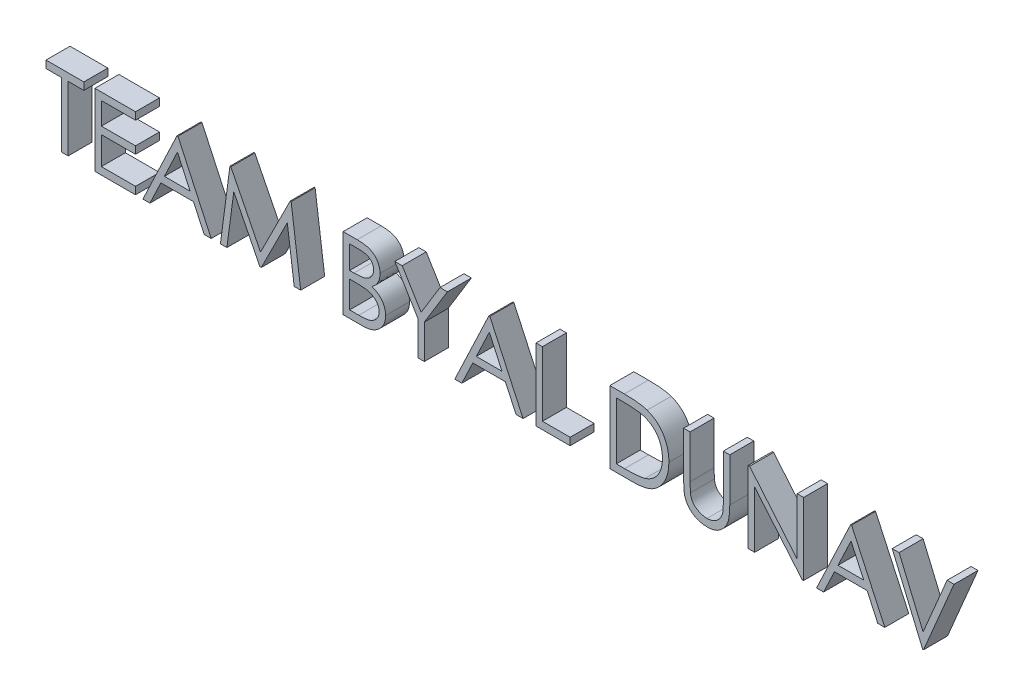
from build123d import *

# Parameters (mm, degrees)
BOSS_EXTRUDE1_DEPTH    = 10
BOSS_EXTRUDE1_2_DEPTH  = 10
BOSS_EXTRUDE1_3_DEPTH  = 10
BOSS_EXTRUDE1_4_DEPTH  = 10
BOSS_EXTRUDE1_5_DEPTH  = 10
BOSS_EXTRUDE1_6_DEPTH  = 10
BOSS_EXTRUDE1_7_DEPTH  = 10
BOSS_EXTRUDE1_8_DEPTH  = 10
BOSS_EXTRUDE1_9_DEPTH  = 10
BOSS_EXTRUDE1_10_DEPTH = 10
BOSS_EXTRUDE1_11_DEPTH = 10
BOSS_EXTRUDE1_12_DEPTH = 10
BOSS_EXTRUDE1_13_DEPTH = 10


with BuildPart() as part:
    # Sketch1 → Boss-Extrude1 (new body)
    with BuildSketch(Plane.XY):
        Polygon((-119.615384615, 1.923076923), (-119.615384615, 5), (-103.846153846, 5), (-103.846153846, 1.923076923), (-110.384615385, 1.923076923), (-110.384615385, -25), (-113.076923077, -25), (-113.076923077, 1.923076923), align=None)
    extrude(amount=BOSS_EXTRUDE1_DEPTH)


with BuildPart() as body_2:
    # Sketch1 → Boss-Extrude1 2 (new body)
    with BuildSketch(Plane.XY):
        Polygon((-99.230769231, 5), (-82.307692308, 5), (-82.307692308, 1.923076923), (-96.538461538, 1.923076923), (-96.538461538, -7.307692308), (-82.307692308, -7.307692308), (-82.307692308, -10.384615385), (-96.538461538, -10.384615385), (-96.538461538, -21.923076923), (-82.307692308, -21.923076923), (-82.307692308, -25), (-99.230769231, -25), align=None)
    extrude(amount=BOSS_EXTRUDE1_2_DEPTH)


with BuildPart() as body_3:
    # Sketch1 → Boss-Extrude1 3 (new body)
    with BuildSketch(Plane.XY):
        Polygon((-64.615384615, 5), (-50.769230769, -25), (-53.695913462, -25), (-58.131009615, -15.384615385), (-71.730769231, -15.384615385), (-76.292067308, -25), (-79.230769231, -25), (-65, 5), align=None)
        Polygon((-64.837740385, -0.847355769), (-70.270432692, -12.307692308), (-59.549278846, -12.307692308), align=None, mode=Mode.SUBTRACT)
    extrude(amount=BOSS_EXTRUDE1_3_DEPTH)


with BuildPart() as body_4:
    # Sketch1 → Boss-Extrude1 4 (new body)
    with BuildSketch(Plane.XY):
        Polygon((-46.923076923, -25), (-42.962740385, 5), (-42.578125, 5), (-30.192307692, -19.615384615), (-17.836538462, 5), (-17.445913462, 5), (-13.461538462, -25), (-16.165865385, -25), (-19.038461538, -3.413461538), (-29.867788462, -25), (-30.474759615, -25), (-41.346153846, -3.365384615), (-44.212740385, -25), align=None)
    extrude(amount=BOSS_EXTRUDE1_4_DEPTH)


with BuildPart() as body_5:
    # Sketch1 → Boss-Extrude1 5 (new body)
    with BuildSketch(Plane.XY):
        with BuildLine():
            Line((4.230769231, 5), (10.084134615, 5))
            add(Edge.make_bspline(
                [(10.084134615, 5), (10.370664428, 4.998493568), (10.926030517, 4.995573728), (11.733625733, 4.950289747), (12.49004411, 4.888544005), (13.195505015, 4.790571782), (13.849682465, 4.672356549), (14.454547927, 4.529198126), (15.008177975, 4.357541437), (15.669144287, 4.084573312), (16.422749951, 3.678946155), (17.238736174, 3.079558454), (17.936486798, 2.346423056), (18.538083802, 1.519428866), (19.016379113, 0.60969368), (19.362401662, -0.361099367), (19.581469165, -1.380428583), (19.603998601, -2.080227251), (19.615384615, -2.433894231)],
                knots=[0, 0, 0, 0, 1.001505555, 1.941167018, 2.826882275, 3.653841531, 4.429895133, 5.150066043, 5.825578002, 6.45369114, 7.647487171, 8.808567382, 9.977351308, 11.170798116, 12.373658725, 13.556498008, 14.765093433, 16, 16, 16, 16], degree=3))
            add(Edge.make_bspline(
                [(19.615384615, -2.433894231), (19.606014172, -2.765201851), (19.587600366, -3.416252568), (19.411519572, -4.368487791), (19.135856699, -5.274926809), (18.752668849, -6.132261541), (18.254651739, -6.921121083), (17.664437579, -7.647869077), (16.952350701, -8.28173528), (16.418837215, -8.636103016), (16.147836538, -8.816105769)],
                knots=[0, 0, 0, 0, 1.044552857, 2.05264487, 3.044412934, 4.028983338, 5.005914585, 5.980388656, 6.974128949, 8, 8, 8, 8], degree=3))
            add(Edge.make_bspline(
                [(16.147836538, -8.816105769), (16.488640204, -8.946948617), (17.140682038, -9.197283398), (18.037990716, -9.639873089), (18.811089388, -10.121262607), (19.465922067, -10.64696418), (20.02595911, -11.213611129), (20.514984323, -11.829512108), (20.932253244, -12.502701462), (21.289792589, -13.226160336), (21.568781927, -13.992501494), (21.77771825, -14.794536717), (21.897439242, -15.629390047), (21.914476168, -16.197550442), (21.923076923, -16.484375)],
                knots=[0, 0, 0, 0, 1.27268992, 2.434971085, 3.483601985, 4.442670788, 5.356604649, 6.2567628, 7.179492994, 8.113709626, 9.066344395, 10.018646069, 10.999752585, 12, 12, 12, 12], degree=3))
            add(Edge.make_bspline(
                [(21.923076923, -16.484375), (21.914703957, -16.777233904), (21.898229912, -17.353442002), (21.776687297, -18.199914584), (21.570894951, -19.008842698), (21.287427982, -19.785458549), (20.917465286, -20.528259702), (20.467225591, -21.238087679), (19.930383618, -21.907810513), (19.329844741, -22.544870139), (18.650454922, -23.117679745), (17.917462737, -23.627814374), (17.121637138, -24.047352049), (16.276048618, -24.399775091), (15.371211623, -24.668979649), (14.411189274, -24.857315997), (13.396809544, -24.984216314), (12.700725963, -24.994649499), (12.34375, -25)],
                knots=[0, 0, 0, 0, 0.978564426, 1.925352924, 2.850884081, 3.763762016, 4.682927383, 5.618979971, 6.567305752, 7.547517671, 8.540179244, 9.531824382, 10.526200242, 11.540722885, 12.589160233, 13.674978461, 14.80764778, 16, 16, 16, 16], degree=3))
            Line((12.34375, -25), (4.230769231, -25))
            Line((4.230769231, -25), (4.230769231, 5))
        make_face()
        with BuildLine():
            Line((6.923076923, 1.923076923), (6.923076923, -7.692307692))
            Line((6.923076923, -7.692307692), (8.731971154, -7.692307692))
            add(Edge.make_bspline(
                [(8.731971154, -7.692307692), (8.9963894, -7.688879781), (9.507299336, -7.682256357), (10.247184164, -7.663283354), (10.933970034, -7.610157267), (11.566471461, -7.55704645), (12.143692409, -7.470692841), (12.664354079, -7.367903216), (13.136627767, -7.259192601), (13.681252443, -7.074311285), (14.299020573, -6.801074069), (14.957590037, -6.377029759), (15.538171205, -5.871963875), (16.028432814, -5.289184203), (16.42967399, -4.647474038), (16.708362977, -3.957072206), (16.897339698, -3.23518536), (16.914409967, -2.739600336), (16.923076923, -2.487980769)],
                knots=[0, 0, 0, 0, 1.156816544, 2.235205308, 3.236616184, 4.169592532, 5.011045266, 5.787822928, 6.49130361, 7.128639758, 8.301311294, 9.436451833, 10.541879658, 11.654887649, 12.756523258, 13.837046038, 14.901820046, 16, 16, 16, 16], degree=3))
            add(Edge.make_bspline(
                [(16.923076923, -2.487980769), (16.918566807, -2.321474156), (16.909719722, -1.994853253), (16.837262843, -1.518715931), (16.714112205, -1.070912338), (16.555932549, -0.645305678), (16.334886645, -0.255204105), (16.074628388, 0.11288043), (15.760179615, 0.446412874), (15.402259792, 0.758151431), (14.99075731, 1.034533098), (14.525917666, 1.276596782), (14.001451863, 1.471517725), (13.42619882, 1.642227603), (12.791303784, 1.762127265), (12.104093326, 1.862013445), (11.358938592, 1.912865519), (10.843409142, 1.919597201), (10.576923077, 1.923076923)],
                knots=[0, 0, 0, 0, 0.91205012, 1.789085906, 2.630437955, 3.453916878, 4.269457761, 5.079663411, 5.91843418, 6.774407191, 7.675494373, 8.627863946, 9.638891023, 10.736472738, 11.911756761, 13.175263542, 14.539845004, 16, 16, 16, 16], degree=3))
            Line((10.576923077, 1.923076923), (6.923076923, 1.923076923))
        make_face(mode=Mode.SUBTRACT)
        with BuildLine():
            Line((6.923076923, -10.769230769), (6.923076923, -21.923076923))
            Line((6.923076923, -21.923076923), (10.757211538, -21.923076923))
            add(Edge.make_bspline(
                [(10.757211538, -21.923076923), (11.031659475, -21.91978766), (11.560621691, -21.913448038), (12.324346521, -21.892751856), (13.032201696, -21.845675207), (13.680957145, -21.771567924), (14.277618168, -21.691181217), (14.815027051, -21.583084524), (15.297540138, -21.459236291), (15.857034204, -21.267800529), (16.487064275, -20.970402206), (17.166014473, -20.521994551), (17.769667771, -19.987794771), (18.282284279, -19.369529792), (18.702395609, -18.697261275), (19.008013795, -17.984586847), (19.196506853, -17.243282326), (19.219325447, -16.737853362), (19.230769231, -16.484375)],
                knots=[0, 0, 0, 0, 1.160039823, 2.235823828, 3.228722157, 4.157150951, 4.99529583, 5.772374946, 6.472645482, 7.099169577, 8.269452708, 9.405989375, 10.527446681, 11.663510218, 12.788923519, 13.866172445, 14.929861265, 16, 16, 16, 16], degree=3))
            add(Edge.make_bspline(
                [(19.230769231, -16.484375), (19.228402622, -16.325860653), (19.223707579, -16.011388809), (19.152902308, -15.549253216), (19.049926281, -15.101602873), (18.916799705, -14.66722224), (18.722918558, -14.253964729), (18.496576744, -13.853657076), (18.231193301, -13.465770109), (17.81767188, -12.975379365), (17.216197726, -12.410376398), (16.361568223, -11.857197807), (15.389805669, -11.411073746), (14.684998587, -11.221649663), (14.320913462, -11.123798077)],
                knots=[0, 0, 0, 0, 0.723448775, 1.435228256, 2.130040452, 2.821711965, 3.505591119, 4.210454504, 4.921174351, 5.648778258, 7.137944449, 8.670945889, 10.280296675, 12, 12, 12, 12], degree=3))
            add(Edge.make_bspline(
                [(14.320913462, -11.123798077), (14.174949783, -11.094183072), (13.85847042, -11.029971631), (13.342405445, -10.962191317), (12.753240854, -10.901805089), (12.089616192, -10.857138023), (11.35069184, -10.81096765), (10.53488968, -10.79301204), (9.645541268, -10.771589811), (9.028463791, -10.770037232), (8.707932692, -10.769230769)],
                knots=[0, 0, 0, 0, 0.634451884, 1.375622551, 2.216452059, 3.157844607, 4.20941857, 5.370758133, 6.634282058, 8, 8, 8, 8], degree=3))
            Line((8.707932692, -10.769230769), (6.923076923, -10.769230769))
        make_face(mode=Mode.SUBTRACT)
    extrude(amount=BOSS_EXTRUDE1_5_DEPTH)


with BuildPart() as body_6:
    # Sketch1 → Boss-Extrude1 6 (new body)
    with BuildSketch(Plane.XY):
        Polygon((25.769230769, 5), (28.852163462, 5), (36.736778846, -7.890625), (44.609375, 5), (47.692307692, 5), (38.076923077, -10.739182692), (38.076923077, -25), (35.384615385, -25), (35.384615385, -10.739182692), align=None)
    extrude(amount=BOSS_EXTRUDE1_6_DEPTH)


with BuildPart() as body_7:
    # Sketch1 → Boss-Extrude1 7 (new body)
    with BuildSketch(Plane.XY):
        Polygon((65.384615385, 5), (79.230769231, -25), (76.304086538, -25), (71.868990385, -15.384615385), (58.269230769, -15.384615385), (53.707932692, -25), (50.769230769, -25), (65, 5), align=None)
        Polygon((65.162259615, -0.847355769), (59.729567308, -12.307692308), (70.450721154, -12.307692308), align=None, mode=Mode.SUBTRACT)
    extrude(amount=BOSS_EXTRUDE1_7_DEPTH)


with BuildPart() as body_8:
    # Sketch1 → Boss-Extrude1 8 (new body)
    with BuildSketch(Plane.XY):
        Polygon((84.615384615, 5), (87.307692308, 5), (87.307692308, -21.923076923), (98.846153846, -21.923076923), (98.846153846, -25), (84.615384615, -25), align=None)
    extrude(amount=BOSS_EXTRUDE1_8_DEPTH)


with BuildPart() as body_9:
    # Sketch1 → Boss-Extrude1 9 (new body)
    with BuildSketch(Plane.XY):
        with BuildLine():
            Line((115.384615385, -25), (115.384615385, 5))
            Line((115.384615385, 5), (121.442307692, 5))
            add(Edge.make_bspline(
                [(121.442307692, 5), (121.969184734, 4.996206543), (122.987108437, 4.988877604), (124.458072272, 4.942408537), (125.81907595, 4.860204544), (127.065643314, 4.740465748), (128.20119656, 4.593439746), (129.222556058, 4.409150566), (130.135002997, 4.191537677), (130.69616963, 4.006005246), (130.961538462, 3.918269231)],
                knots=[0, 0, 0, 0, 1.314313732, 2.53924729, 3.670748893, 4.714932338, 5.66265055, 6.526160246, 7.303039223, 8, 8, 8, 8], degree=3))
            add(Edge.make_bspline(
                [(130.961538462, 3.918269231), (131.308636227, 3.78600604), (131.994960732, 3.524478947), (132.97216464, 3.031139222), (133.892096323, 2.472169778), (134.759688993, 1.846833812), (135.555124648, 1.137425111), (136.309478048, 0.374078663), (136.991889967, -0.470964253), (137.616818218, -1.380178436), (138.180266728, -2.342853169), (138.670030938, -3.357154101), (139.076779453, -4.41793017), (139.414435681, -5.522231439), (139.680548174, -6.672486106), (139.862107588, -7.870033529), (139.98185893, -9.110140867), (139.993893656, -9.95163627), (140, -10.378605769)],
                knots=[0, 0, 0, 0, 0.984719456, 1.947108742, 2.898477687, 3.838006223, 4.779231079, 5.722358779, 6.681677486, 7.655904652, 8.64651281, 9.637519902, 10.640069247, 11.656948941, 12.698408672, 13.768548281, 14.867775369, 16, 16, 16, 16], degree=3))
            add(Edge.make_bspline(
                [(140, -10.378605769), (139.99460885, -10.749416385), (139.983985026, -11.480137433), (139.88859089, -12.557059395), (139.749936719, -13.602032864), (139.535272166, -14.610081721), (139.274679193, -15.590037875), (138.940700754, -16.531457112), (138.558110786, -17.442975478), (138.11196897, -18.312268128), (137.62218567, -19.135839891), (137.096570728, -19.912201561), (136.535684768, -20.630274891), (135.934179343, -21.292234422), (135.299827488, -21.897082237), (134.628476083, -22.44987094), (133.91839279, -22.939784267), (133.172758024, -23.386073766), (132.369819774, -23.775391099), (131.494369492, -24.104791184), (130.542673681, -24.377762172), (129.517068336, -24.605512708), (128.415781384, -24.786175302), (127.237733105, -24.907258666), (125.984733479, -24.989140946), (125.124339777, -24.996310032), (124.681490385, -25)],
                knots=[0, 0, 0, 0, 1.105936401, 2.179363191, 3.223086493, 4.248585256, 5.251745608, 6.245858792, 7.225916811, 8.198733463, 9.158002045, 10.082870192, 10.993790845, 11.873723703, 12.748670949, 13.606408763, 14.465103618, 15.319838547, 16.196477973, 17.123216899, 18.106603292, 19.147568657, 20.255746949, 21.433717677, 22.679120308, 24, 24, 24, 24], degree=3))
            Line((124.681490385, -25), (115.384615385, -25))
        make_face()
        with BuildLine():
            Line((118.076923077, -21.923076923), (121.520432692, -21.923076923))
            add(Edge.make_bspline(
                [(121.520432692, -21.923076923), (122.015247299, -21.920950383), (122.966956999, -21.916860267), (124.335454119, -21.880969954), (125.585848946, -21.822324776), (126.718319026, -21.74025268), (127.732224949, -21.63166455), (128.629685662, -21.510593955), (129.407759305, -21.359758663), (129.87858305, -21.223036154), (130.096153846, -21.159855769)],
                knots=[0, 0, 0, 0, 1.375205317, 2.645023457, 3.804390687, 4.853969522, 5.800190428, 6.637939096, 7.370582563, 8, 8, 8, 8], degree=3))
            add(Edge.make_bspline(
                [(130.096153846, -21.159855769), (130.36999695, -21.063413841), (130.91114242, -20.872833499), (131.69012315, -20.525196403), (132.416611761, -20.113407234), (133.103269121, -19.655673457), (133.740354739, -19.135850583), (134.335418593, -18.565242107), (134.887262605, -17.940944035), (135.390185245, -17.263731222), (135.840256422, -16.537818688), (136.230009817, -15.770342971), (136.571594374, -14.969713169), (136.839696596, -14.123634666), (137.049830175, -13.239671308), (137.198670357, -12.317760909), (137.291367995, -11.358075636), (137.302180406, -10.705343142), (137.307692308, -10.372596154)],
                knots=[0, 0, 0, 0, 0.998632004, 1.973411704, 2.929992603, 3.868527914, 4.809262121, 5.754881198, 6.702106254, 7.672490631, 8.653608572, 9.636854334, 10.631411391, 11.644891563, 12.686317036, 13.754757253, 14.855430412, 16, 16, 16, 16], degree=3))
            add(Edge.make_bspline(
                [(137.307692308, -10.372596154), (137.303292702, -10.021737751), (137.294649637, -9.332473314), (137.18601269, -8.321124497), (137.0272565, -7.348433207), (136.797682049, -6.414334389), (136.505131658, -5.517005656), (136.140034729, -4.661409855), (135.722892278, -3.838510979), (135.226577962, -3.06730213), (134.683015734, -2.337932623), (134.079776768, -1.669747632), (133.426445009, -1.061225058), (132.7301463, -0.502888093), (131.971256877, -0.017199442), (131.167653813, 0.417257824), (130.30754806, 0.785965464), (129.709153525, 0.982070002), (129.405048077, 1.081730769)],
                knots=[0, 0, 0, 0, 1.122418816, 2.205001699, 3.251619955, 4.274784885, 5.280384055, 6.268708349, 7.249350384, 8.229342522, 9.199999885, 10.157847722, 11.105861043, 12.055065948, 13.010012805, 13.98527497, 14.976112212, 16, 16, 16, 16], degree=3))
            add(Edge.make_bspline(
                [(129.405048077, 1.081730769), (129.153466822, 1.151300151), (128.618536048, 1.299223744), (127.745626357, 1.46058408), (126.76321079, 1.602908358), (125.666927638, 1.723405838), (124.45802656, 1.809868592), (123.135577806, 1.874765574), (121.699009767, 1.91853671), (120.703159476, 1.921525629), (120.186298077, 1.923076923)],
                knots=[0, 0, 0, 0, 0.674548936, 1.434276114, 2.292660221, 3.240891867, 4.284742987, 5.42552168, 6.663806718, 8, 8, 8, 8], degree=3))
            Line((120.186298077, 1.923076923), (118.076923077, 1.923076923))
            Line((118.076923077, 1.923076923), (118.076923077, -21.923076923))
        make_face(mode=Mode.SUBTRACT)
    extrude(amount=BOSS_EXTRUDE1_9_DEPTH)


with BuildPart() as body_10:
    # Sketch1 → Boss-Extrude1 10 (new body)
    with BuildSketch(Plane.XY):
        with BuildLine():
            Line((146.153846154, 5), (148.846153846, 5))
            Line((148.846153846, 5), (148.846153846, -12.974759615))
            add(Edge.make_bspline(
                [(148.846153846, -12.974759615), (148.845753184, -13.229165922), (148.844992857, -13.71194573), (148.850071547, -14.399102592), (148.864294705, -15.010009383), (148.873261787, -15.547020934), (148.89321036, -16.007673055), (148.909479334, -16.394461432), (148.930398391, -16.705554596), (148.955539398, -16.887105391), (148.966346154, -16.965144231)],
                knots=[0, 0, 0, 0, 1.528628734, 2.90083645, 4.128790002, 5.200304208, 6.127813768, 6.898992206, 7.526736466, 8, 8, 8, 8], degree=3))
            add(Edge.make_bspline(
                [(148.966346154, -16.965144231), (149.010724372, -17.246687917), (149.096980255, -17.793911309), (149.31680635, -18.573125154), (149.623813502, -19.275394796), (149.987611011, -19.922634434), (150.467033394, -20.496828949), (151.04134941, -21.025785973), (151.737158855, -21.488401441), (152.510821189, -21.9114084), (153.344694654, -22.25139482), (154.196791222, -22.5084808), (155.054302472, -22.665157084), (155.628383887, -22.683298846), (155.913461538, -22.692307692)],
                knots=[0, 0, 0, 0, 1.035780045, 2.013197591, 2.933192213, 3.817615948, 4.702609284, 5.640816605, 6.646850145, 7.73207398, 8.84249596, 9.914020372, 10.964143139, 12, 12, 12, 12], degree=3))
            add(Edge.make_bspline(
                [(155.913461538, -22.692307692), (156.158207885, -22.683103261), (156.646286987, -22.664747562), (157.371484964, -22.551078153), (158.07777161, -22.346216161), (158.76863458, -22.081875375), (159.416214447, -21.732610308), (160.020872521, -21.32914597), (160.560563386, -20.85590989), (161.05306051, -20.332192651), (161.481931389, -19.74128008), (161.853684031, -19.096038897), (162.158192, -18.38675878), (162.30856507, -17.888292304), (162.385817308, -17.632211538)],
                knots=[0, 0, 0, 0, 0.994687771, 1.983630487, 2.973142513, 3.978332533, 4.983357753, 5.956394766, 6.925816176, 7.893390482, 8.871859704, 9.88551698, 10.913711441, 12, 12, 12, 12], degree=3))
            add(Edge.make_bspline(
                [(162.385817308, -17.632211538), (162.411532667, -17.526366616), (162.468836852, -17.290501472), (162.522382952, -16.891747553), (162.57815317, -16.42126729), (162.616849484, -15.875680323), (162.65457423, -15.256814844), (162.677143426, -14.561446923), (162.687575137, -13.792101544), (162.690683825, -13.255211586), (162.692307692, -12.974759615)],
                knots=[0, 0, 0, 0, 0.558680831, 1.244966039, 2.062412453, 2.990489873, 4.051219941, 5.244515665, 6.560634259, 8, 8, 8, 8], degree=3))
            Line((162.692307692, -12.974759615), (162.692307692, 5))
            Line((162.692307692, 5), (165.384615385, 5))
            Line((165.384615385, 5), (165.384615385, -13.118990385))
            add(Edge.make_bspline(
                [(165.384615385, -13.118990385), (165.38243721, -13.445547918), (165.378186369, -14.0828448), (165.341324285, -15.016713592), (165.282550001, -15.902596289), (165.199509247, -16.740611974), (165.089477791, -17.52776191), (164.967118758, -18.270945637), (164.811294189, -18.964828431), (164.629293607, -19.614820583), (164.421234624, -20.233553555), (164.151739067, -20.820770252), (163.848100496, -21.394322249), (163.4879749, -21.94553461), (163.083305906, -22.476847923), (162.625148642, -22.985039995), (162.128655835, -23.47823182), (161.585573895, -23.943772387), (161.004855107, -24.370703903), (160.388226899, -24.746113369), (159.740426015, -25.063458662), (159.063136363, -25.324680871), (158.356068909, -25.521091721), (157.619205826, -25.6674502), (156.850869883, -25.75061275), (156.328315687, -25.76297215), (156.063701923, -25.769230769)],
                knots=[0, 0, 0, 0, 1.316592851, 2.569410997, 3.76748051, 4.895814652, 5.963796859, 6.97159953, 7.931736103, 8.829262218, 9.692595152, 10.560224239, 11.431080259, 12.30701507, 13.211635791, 14.121146779, 15.063487852, 16.031507147, 17.00238618, 17.966455255, 18.938106653, 19.907068911, 20.888905087, 21.893141452, 22.933117798, 24, 24, 24, 24], degree=3))
            add(Edge.make_bspline(
                [(156.063701923, -25.769230769), (155.775109615, -25.76250421), (155.208892539, -25.749306724), (154.374566248, -25.673683152), (153.57473028, -25.531239772), (152.800937048, -25.349868826), (152.063721358, -25.099722506), (151.353206121, -24.807452865), (150.681560283, -24.448504919), (150.037887752, -24.049132979), (149.439389842, -23.599778938), (148.889983529, -23.110006018), (148.388761781, -22.587659926), (147.944172956, -22.027085362), (147.548851088, -21.43264216), (147.208306401, -20.802648675), (146.915907166, -20.137348823), (146.764993734, -19.674892819), (146.688701923, -19.441105769)],
                knots=[0, 0, 0, 0, 1.13879206, 2.234305948, 3.301075583, 4.341971843, 5.366689343, 6.369221514, 7.369726634, 8.367512178, 9.355451585, 10.318319045, 11.268648973, 12.207971039, 13.137398894, 14.081662264, 15.030215811, 16, 16, 16, 16], degree=3))
            add(Edge.make_bspline(
                [(146.688701923, -19.441105769), (146.644326282, -19.281397988), (146.548074527, -18.934988255), (146.445000547, -18.361675495), (146.358351276, -17.70154763), (146.276875063, -16.954559472), (146.22879828, -16.120132044), (146.186648806, -15.198627051), (146.153549216, -14.188930237), (146.153744408, -13.485605817), (146.153846154, -13.118990385)],
                knots=[0, 0, 0, 0, 0.625038921, 1.35572334, 2.194682327, 3.136881307, 4.189498639, 5.346923369, 6.617055217, 8, 8, 8, 8], degree=3))
            Line((146.153846154, -13.118990385), (146.153846154, 5))
        make_face()
    extrude(amount=BOSS_EXTRUDE1_10_DEPTH)


with BuildPart() as body_11:
    # Sketch1 → Boss-Extrude1 11 (new body)
    with BuildSketch(Plane.XY):
        Polygon((173.076923077, -25), (173.076923077, 5), (173.641826923, 5), (193.461538462, -18.611778846), (193.461538462, 5), (196.153846154, 5), (196.153846154, -25), (195.540865385, -25), (175.769230769, -1.442307692), (175.769230769, -25), align=None)
    extrude(amount=BOSS_EXTRUDE1_11_DEPTH)


with BuildPart() as body_12:
    # Sketch1 → Boss-Extrude1 12 (new body)
    with BuildSketch(Plane.XY):
        Polygon((216.153846154, 5), (230, -25), (227.073317308, -25), (222.638221154, -15.384615385), (209.038461538, -15.384615385), (204.477163462, -25), (201.538461538, -25), (215.769230769, 5), align=None)
        Polygon((215.931490385, -0.847355769), (210.498798077, -12.307692308), (221.219951923, -12.307692308), align=None, mode=Mode.SUBTRACT)
    extrude(amount=BOSS_EXTRUDE1_12_DEPTH)


with BuildPart() as body_13:
    # Sketch1 → Boss-Extrude1 13 (new body)
    with BuildSketch(Plane.XY):
        Polygon((233.076923077, 5), (235.961538462, 5), (245.961538462, -18.641826923), (255.961538462, 5), (258.846153846, 5), (246.153846154, -25), (245.769230769, -25), align=None)
    extrude(amount=BOSS_EXTRUDE1_13_DEPTH)


solid = Compound([part.part, body_2.part, body_3.part, body_4.part, body_5.part, body_6.part, body_7.part, body_8.part, body_9.part, body_10.part, body_11.part, body_12.part, body_13.part])
